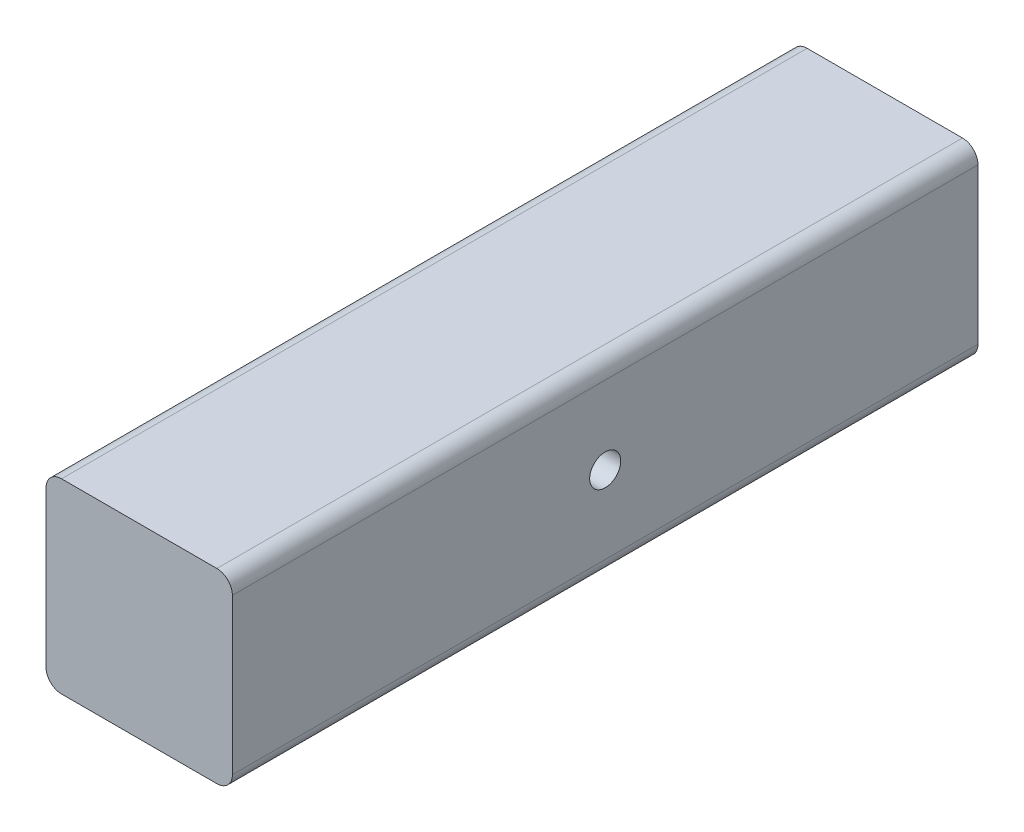
from build123d import *

# Parameters (mm, degrees)
SKETCH1_W           = 38.1
SKETCH1_H           = 38.1
BOSS_EXTRUDE1_DEPTH = 152.4
FILLET1_R           = 3.175
SKETCH2_R           = 3.175
CUT_EXTRUDE1_DEPTH  = 159.241184589


with BuildPart() as part:
    # Sketch1 → Boss-Extrude1 (new body)
    with BuildSketch(Plane.XY):
        Rectangle(SKETCH1_W, SKETCH1_H)
    extrude(amount=BOSS_EXTRUDE1_DEPTH)

    # Fillet1
    fillet1_edges = [part.edges().sort_by_distance(p)[0] for p in [
        (19.05, -19.05, 76.2),
        (-19.05, -19.05, 76.2),
        (-19.05, 19.05, 76.2),
        (19.05, 19.05, 76.2),
    ]]
    fillet(fillet1_edges, radius=FILLET1_R)

    # Sketch2 → Cut-Extrude1 (cut, through all)
    with BuildSketch(Plane.ZY.offset(19.05)):
        with Locations((76.2, 0)):
            Circle(SKETCH2_R)
    extrude(amount=-CUT_EXTRUDE1_DEPTH, mode=Mode.SUBTRACT)


solid = part.part
